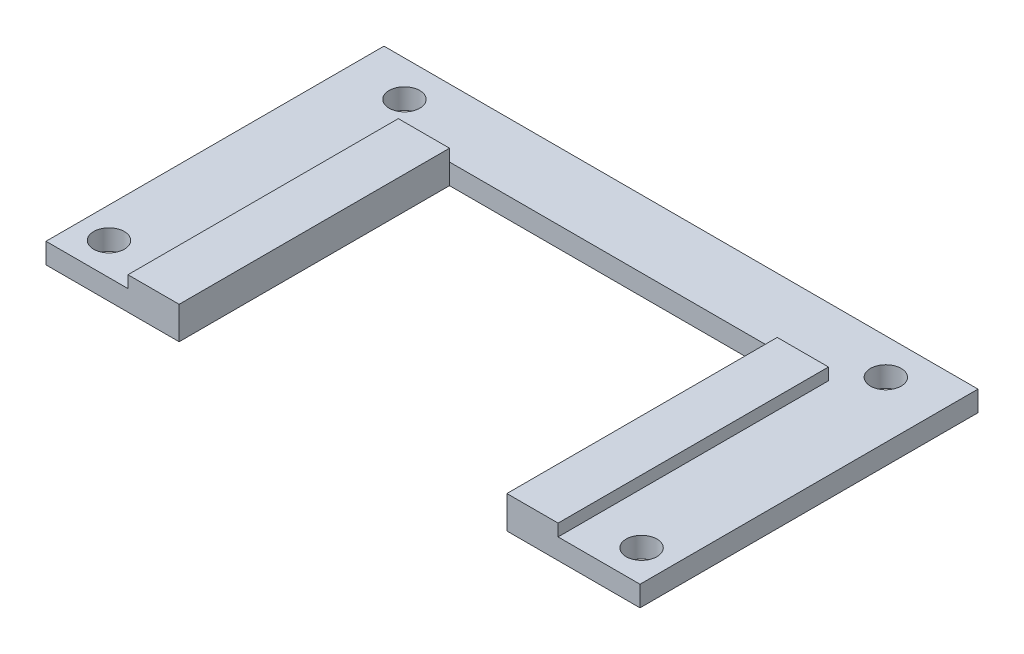
from build123d import *

# Parameters (mm, degrees)
SKETCH1_R           = 1.5
BOSS_EXTRUDE1_DEPTH = 2
SKETCH2_W           = 5
SKETCH2_H           = 26.4
BOSS_EXTRUDE2_DEPTH = 1.17


with BuildPart() as part:
    # Sketch1 → Boss-Extrude1 (new body)
    with BuildSketch(Plane(origin=(0, 0, 0), x_dir=(1, 0, 0), z_dir=(0, 1, 0))):
        Polygon((-3, 0), (0, 0), (10, 0), (10, 26.4), (42, 26.4), (42, 0), (52, 0), (55, 0), (55, 33), (-3, 33), align=None)
        with Locations(Location((0, 3.15, 0), (0, 0, 270))):
            Circle(SKETCH1_R, mode=Mode.SUBTRACT)
        with BuildLine():
            ThreePointArc((53.5, 3.15), (53.060660172, 2.089339828), (52, 1.65))
            ThreePointArc((52, 1.65), (50.939339828, 4.210660172), (53.5, 3.15))
        make_face(mode=Mode.SUBTRACT)
        with Locations(Location((2.5, 29.5, 0), (0, 0, 270))):
            Circle(SKETCH1_R, mode=Mode.SUBTRACT)
        with Locations(Location((49.5, 29.5, 0), (0, 0, 270))):
            Circle(SKETCH1_R, mode=Mode.SUBTRACT)
    extrude(amount=BOSS_EXTRUDE1_DEPTH)

    # Sketch2 → Boss-Extrude2 (add)
    with BuildSketch(Plane(origin=(0, 2, 0), x_dir=(1, 0, 0), z_dir=(0, 1, 0))):
        with Locations((7.5, 13.2)):
            Rectangle(SKETCH2_W, SKETCH2_H)
        with Locations((44.5, 13.2)):
            Rectangle(SKETCH2_W, SKETCH2_H)
    extrude(amount=BOSS_EXTRUDE2_DEPTH)


solid = part.part
